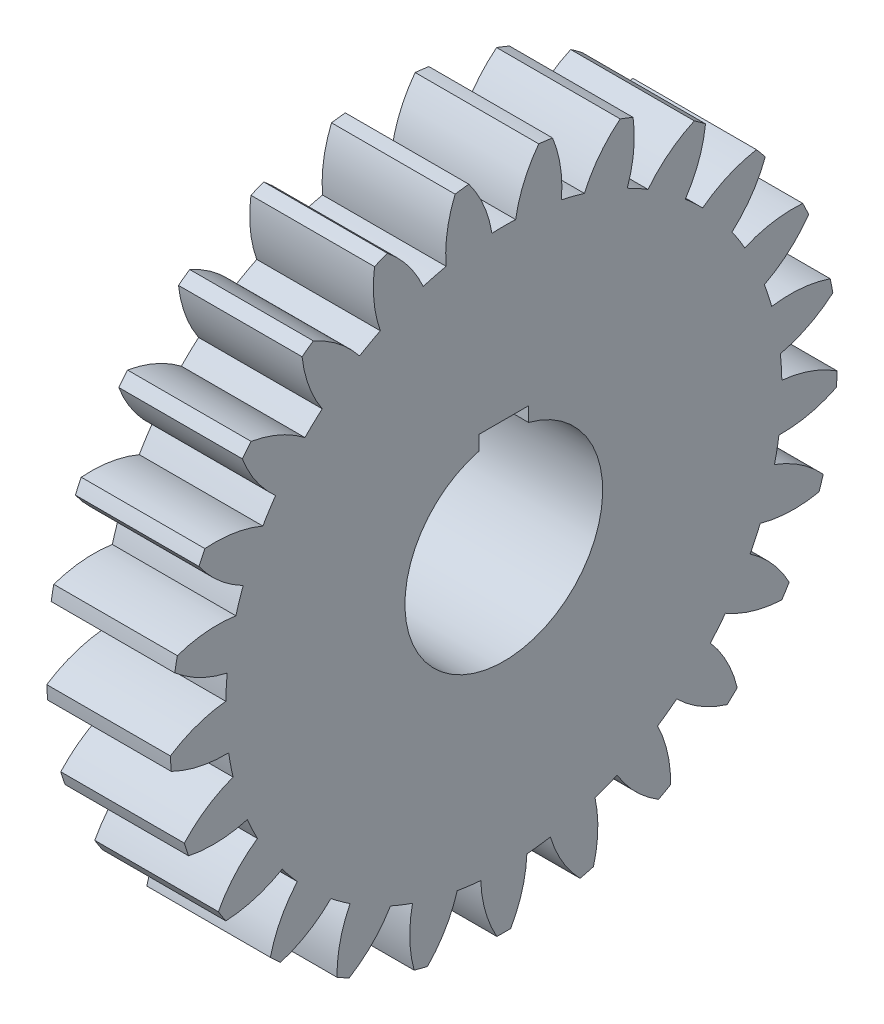
from build123d import *

# Parameters (mm, degrees)
BASPROSKE_W      = 125
BASPROSKE_H      = 337.5
TOOTHCUT_DEPTH   = 494.3938589
TEETHCUTS_COUNT  = 25
TEETHCUTS_ANGLE  = 345.6
HUBNEAONESKE_R   = 175
HUBNEARONE_DEPTH = 45.0000508
BORSKE_R         = 100
BORE_DEPTH       = 170.0000508
KEYSKE_W         = 50
KEYSKE_H         = 111.4
KEYWAY_DEPTH     = 170.0000508


with BuildPart() as part:
    # BasProSke → Base-Revolve (revolve)
    with BuildSketch(Plane(origin=(0, 0, 0), x_dir=(1, 0, 0), z_dir=(0, 1, 0)), mode=Mode.PRIVATE) as base_revolve_sk:
        with Locations((62.5, 168.75)):
            Rectangle(BASPROSKE_W, BASPROSKE_H)
    revolve(base_revolve_sk.sketch.rotate(Axis((-10, 0, 0), (1, 0, 0)), 180), axis=Axis((-10, 0, 0), (1, 0, 0)))

    # TooCutSke → ToothCut (cut, through all)
    with BuildSketch(Plane(origin=(0, 0, 0), x_dir=(0, 0, -1), z_dir=(1, 0, 0))):
        with BuildLine():
            ThreePointArc((11.990378159, 280.993293216), (0, 281.249), (-11.990378159, 280.993293216))
            ThreePointArc((-11.990378159, 280.993293216), (-20.375281475, 309.740422738), (-35.356669359, 335.668439948))
            ThreePointArc((-35.356669359, 335.668439948), (0, 337.5254), (35.356669359, 335.668439948))
            ThreePointArc((35.356669359, 335.668439948), (20.375281475, 309.740422738), (11.990378159, 280.993293216))
        make_face()
    toothcut = extrude(amount=TOOTHCUT_DEPTH, mode=Mode.SUBTRACT)

    # TeethCuts: ToothCut ×25 about axis
    teethcuts_axis = Axis((-10, 0, 0), (1, 0, 0))
    for i in range(1, TEETHCUTS_COUNT):
        add(toothcut.rotate(teethcuts_axis, i * TEETHCUTS_ANGLE / (TEETHCUTS_COUNT - 1)), mode=Mode.SUBTRACT)

    # HubNeaOneSke → HubNearOne (add)
    with BuildSketch(Plane.ZY):
        with Locations(Location((0, 0, 0), (0, 0, 180))):
            Circle(HUBNEAONESKE_R)
    extrude(amount=HUBNEARONE_DEPTH)

    # BorSke → Bore (cut, symmetric)
    with BuildSketch(Plane(origin=(0, 0, 0), x_dir=(0, 0, -1), z_dir=(1, 0, 0))):
        with Locations(Location((0, 0, 0), (0, 0, 180))):
            Circle(BORSKE_R)
    extrude(amount=BORE_DEPTH, both=True, mode=Mode.SUBTRACT)

    # KeySke → Keyway (cut, symmetric)
    with BuildSketch(Plane(origin=(0, 0, 0), x_dir=(0, 0, -1), z_dir=(1, 0, 0))):
        with Locations((0, 55.7)):
            Rectangle(KEYSKE_W, KEYSKE_H)
    extrude(amount=KEYWAY_DEPTH, both=True, mode=Mode.SUBTRACT)


solid = part.part
